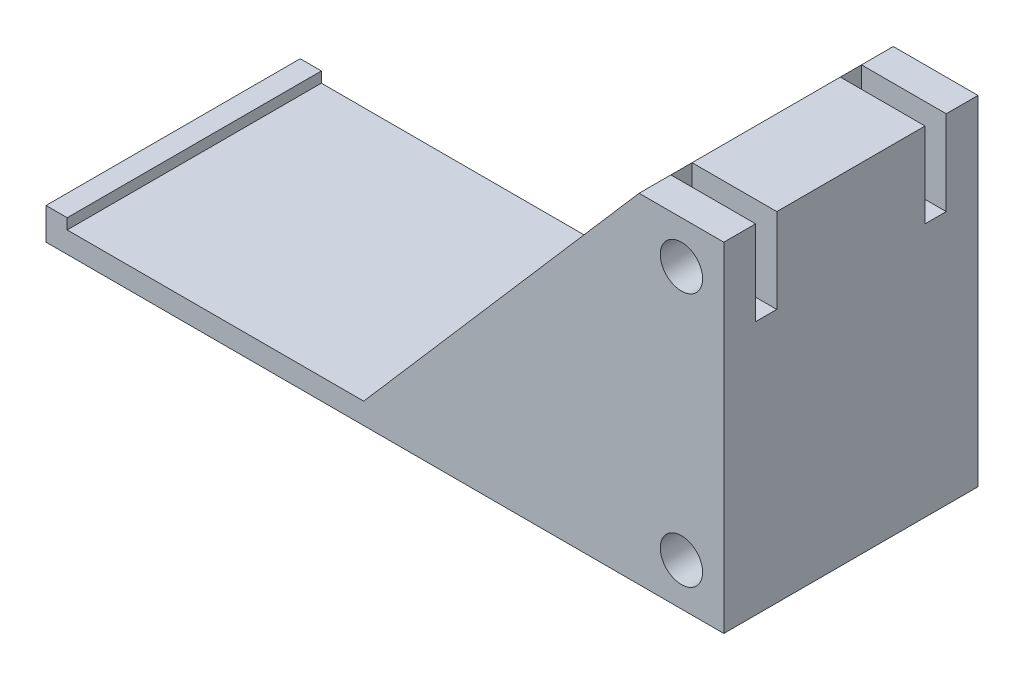
from build123d import *

# Parameters (mm, degrees)
SKETCH1_W               = 381
SKETCH1_H               = 25.4
SKETCH1_W_2             = 25.4
SKETCH1_H_2             = 152.4
BOSS_EXTRUDE1_DEPTH     = 76.2
CUT_EXTRUDE1_DEPTH      = 470.041106941
CUT_EXTRUDE1_DEPTH_BACK = 470.041106941
SKETCH2_R               = 12.7
SKETCH4_W               = 50.8
SKETCH4_H               = 50.8
CUT_EXTRUDE2_DEPTH      = 6.35
CUT_EXTRUDE3_DEPTH      = 451.089146725
CUT_EXTRUDE3_DEPTH_BACK = 451.089146725
SKETCH5_W               = 381
SKETCH5_H               = 25.4
BOSS_EXTRUDE2_DEPTH     = 76.2


with BuildPart() as part:
    # Sketch1 → Boss-Extrude1 (new, symmetric)
    with BuildSketch(Plane.XY):
        with Locations((-215.9, 12.7)):
            Rectangle(SKETCH1_W, SKETCH1_H)
        with Locations((-12.7, 76.2)):
            Rectangle(SKETCH1_W_2, SKETCH1_H_2)
        Polygon((0, 152.4), (0, 0), (-25.4, 0), (-25.4, -25.4), (25.4, -25.4), (25.4, 177.8), (-25.4, 177.8), (-25.4, 152.4), align=None)
    extrude(amount=BOSS_EXTRUDE1_DEPTH, both=True)

    # Sketch2 → Cut-Extrude1 (cut, two sides: drawn at the far end of the back side and taken through both)
    with BuildSketch(Plane.XY.offset(76.2).offset(-CUT_EXTRUDE1_DEPTH_BACK)):
        Circle(SKETCH2_R)
        with Locations((0, 152.4)):
            Circle(SKETCH2_R)
    extrude(amount=CUT_EXTRUDE1_DEPTH + CUT_EXTRUDE1_DEPTH_BACK, mode=Mode.SUBTRACT)

    # Sketch4 → Cut-Extrude2 (cut, symmetric)
    with BuildSketch(Plane.XY.offset(50.8)):
        with Locations((0, 152.4)):
            Rectangle(SKETCH4_W, SKETCH4_H)
    cut_extrude2 = extrude(amount=CUT_EXTRUDE2_DEPTH, both=True, mode=Mode.SUBTRACT)

    # Mirror1: Cut-Extrude2 across plane
    add(cut_extrude2.mirror(Plane.XY), mode=Mode.SUBTRACT)

    # Sketch5 → Cut-Extrude3 (cut, two sides: drawn at the far end of the back side and taken through both)
    with BuildSketch(Plane.XY.offset(-CUT_EXTRUDE3_DEPTH_BACK)):
        with Locations((-215.9, 12.7)):
            Rectangle(SKETCH5_W, SKETCH5_H)
    extrude(amount=CUT_EXTRUDE3_DEPTH + CUT_EXTRUDE3_DEPTH_BACK, mode=Mode.SUBTRACT)

    # Sketch6 → Boss-Extrude2 (add, symmetric)
    with BuildSketch(Plane.XY):
        Polygon((-25.4, -25.4), (-381, -25.4), (-381, -6.35), (-368.3, -6.35), (-368.3, -12.7), (-190.5, -12.7), (-25.4, 177.8), align=None)
    extrude(amount=BOSS_EXTRUDE2_DEPTH, both=True)


solid = part.part
